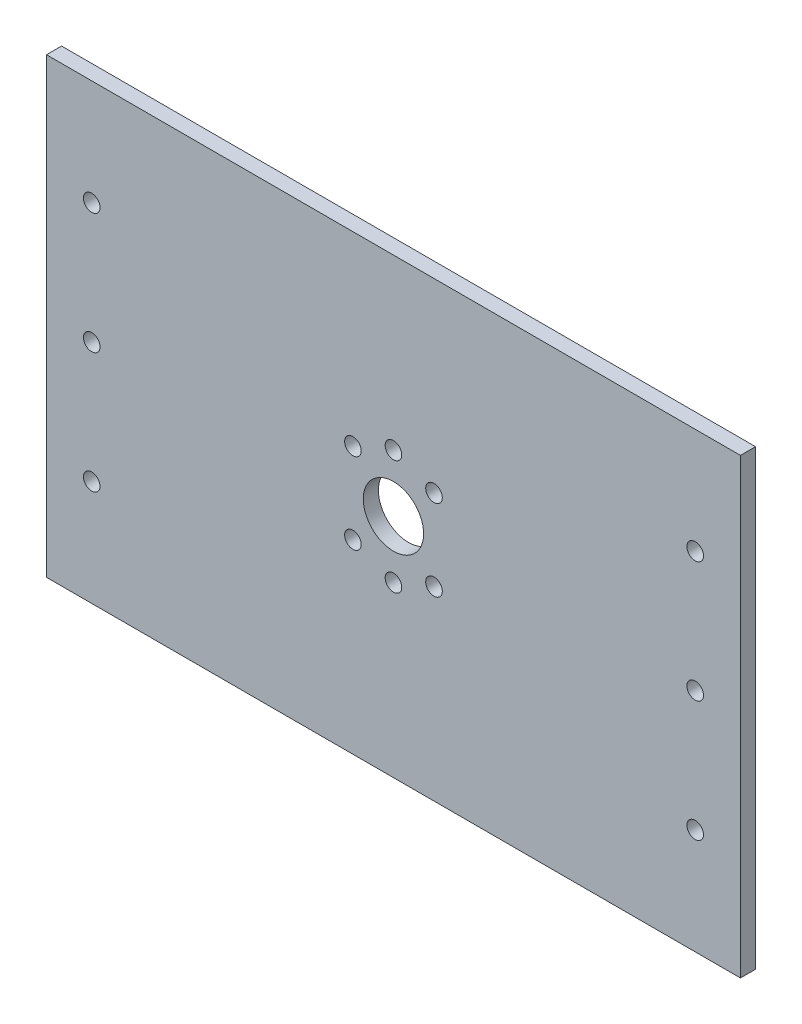
from build123d import *

# Parameters (mm, degrees)
SKETCH_1_W      = 230
SKETCH_1_H      = 150
SKETCH_1_R      = 10
SKETCH_1_R_2    = 2.75
EXTRUDE_1_DEPTH = 5


with BuildPart() as part:
    # 草图1 → 凸台-拉伸1 (new body)
    with BuildSketch(Plane.XY):
        Rectangle(SKETCH_1_W, SKETCH_1_H)
        Circle(SKETCH_1_R, mode=Mode.SUBTRACT)
        with Locations((0, 19)):
            Circle(SKETCH_1_R_2, mode=Mode.SUBTRACT)
        with Locations((13.435028843, 13.435028843)):
            Circle(SKETCH_1_R_2, mode=Mode.SUBTRACT)
        with Locations(Location((-13.435028843, 13.435028843, 0), (0, 0, 180))):
            Circle(SKETCH_1_R_2, mode=Mode.SUBTRACT)
        with Locations(Location((13.435028843, -13.435028843, 0), (0, 0, 180))):
            Circle(SKETCH_1_R_2, mode=Mode.SUBTRACT)
        with Locations((-13.435028843, -13.435028843)):
            Circle(SKETCH_1_R_2, mode=Mode.SUBTRACT)
        with Locations(Location((0, -19, 0), (0, 0, 180))):
            Circle(SKETCH_1_R_2, mode=Mode.SUBTRACT)
        with Locations((-100, 0)):
            Circle(SKETCH_1_R_2, mode=Mode.SUBTRACT)
        with Locations((-100, 40)):
            Circle(SKETCH_1_R_2, mode=Mode.SUBTRACT)
        with Locations(Location((-100, -40, 0), (0, 0, 180))):
            Circle(SKETCH_1_R_2, mode=Mode.SUBTRACT)
        with Locations((100, -40)):
            Circle(SKETCH_1_R_2, mode=Mode.SUBTRACT)
        with Locations(Location((100, 0, 0), (0, 0, 180))):
            Circle(SKETCH_1_R_2, mode=Mode.SUBTRACT)
        with Locations(Location((100, 40, 0), (0, 0, 180))):
            Circle(SKETCH_1_R_2, mode=Mode.SUBTRACT)
    extrude(amount=EXTRUDE_1_DEPTH)


solid = part.part
